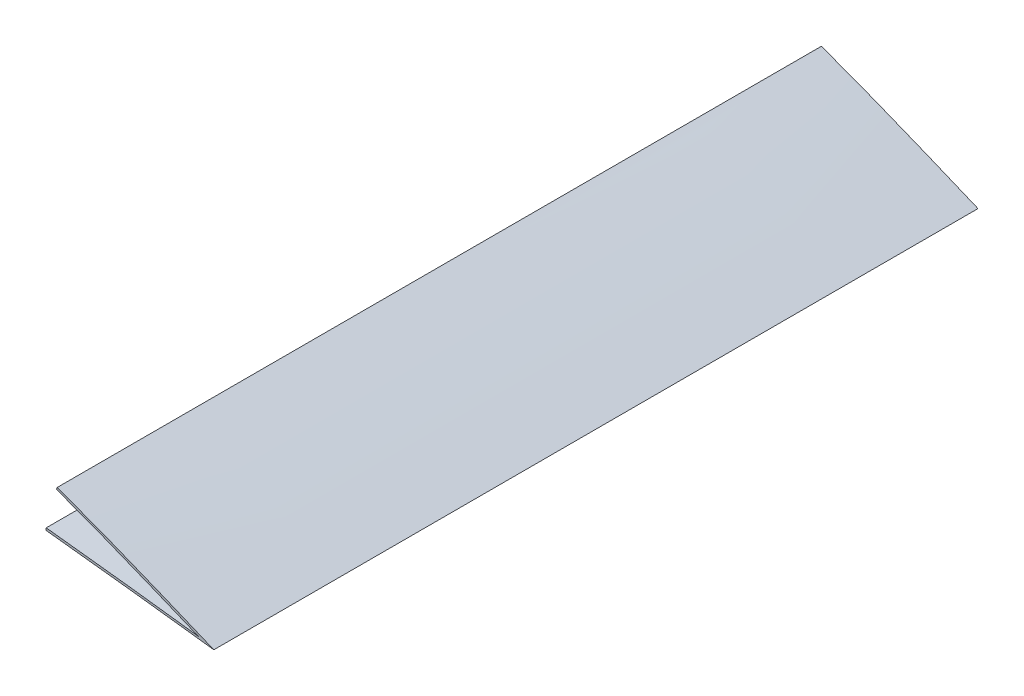
from build123d import *

# Parameters (mm, degrees)
BOSS_EXTRUDE1_DEPTH = 174.625


with BuildPart() as part:
    # Sketch2 → Boss-Extrude1 (new body)
    with BuildSketch(Plane.XY):
        with BuildLine():
            Line((1990.421486693, 2953.497553429), (1990.598028741, 2953.970958412))
            add(Edge.make_bspline(
                [(2026.378123223, 2939.726019749), (2025.772367033, 2939.966817705), (2025.167001193, 2940.208065776), (2024.563270161, 2940.45119895), (2024.252449888, 2940.576371776), (2023.942062924, 2940.702044254), (2023.632279085, 2940.828412198), (2019.922907303, 2942.341550154), (2016.300010508, 2943.954402829), (2008.840382128, 2946.884862912), (2005.182046354, 2948.446003317), (1998.49830219, 2950.992561795), (1995.575349012, 2952.143708473), (1991.935867823, 2953.473628662), (1991.266522782, 2953.72164072), (1990.598028741, 2953.970958412)],
                knots=[0.099020879, 0.099020879, 0.099020879, 0.099020879, 0.175577174, 0.175577174, 0.175577174, 0.214990832, 0.214990832, 0.214990832, 0.686932531, 0.686932531, 1.158874229, 1.158874229, 1.531655023, 1.531655023, 1.615895701, 1.615895701, 1.615895701, 1.615895701], degree=3))
            add(Edge.make_bspline(
                [(1988.02305883, 2944.185998102), (1988.486093696, 2944.140440591), (1990.118619768, 2943.977588834), (1992.878565386, 2943.651927789), (1996.260561822, 2943.27824299), (1999.50276369, 2942.881360992), (2002.595054506, 2942.588170362), (2005.514279258, 2942.198699316), (2008.286301016, 2941.928612986), (2010.885526485, 2941.569057415), (2013.333900984, 2941.299836639), (2015.607898689, 2941.033281035), (2017.705847242, 2940.755050343), (2019.629402987, 2940.578518098), (2021.367662073, 2940.314827517), (2022.931203684, 2940.147471412), (2024.319748194, 2939.977883581), (2025.440549175, 2939.811318081), (2026.113682533, 2939.755557142), (2026.378123223, 2939.726019749)],
                knots=[28.432980691, 28.432980691, 28.432980691, 28.432980691, 28.487933475, 28.626756368, 28.761203264, 28.889815923, 29.012534113, 29.128021866, 29.237609431, 29.341433808, 29.437893302, 29.528519208, 29.611854391, 29.687830524, 29.756590169, 29.81943804, 29.873536901, 29.921805305, 29.953240386, 29.953240386, 29.953240386, 29.953240386], degree=3))
            Line((1988.02305883, 2944.185998102), (1988.074605977, 2944.709910093))
            add(Edge.make_bspline(
                [(1988.074605977, 2944.709910093), (1989.230150517, 2944.58289678), (1990.385621975, 2944.45341125), (1998.052162808, 2943.575786345), (2004.595655519, 2942.866835827), (2014.99093127, 2941.587524984), (2018.884584402, 2941.067615831), (2022.866460843, 2940.614570977)],
                knots=[28.432746502, 28.432746502, 28.432746502, 28.432746502, 28.569989508, 28.569989508, 29.343340852, 29.343340852, 29.81381441, 29.81381441, 29.81381441, 29.81381441], degree=3))
            add(Edge.make_bspline(
                [(2022.866460843, 2940.614570977), (2021.798028907, 2941.061512065), (2020.716308213, 2941.506999086), (2015.217323697, 2943.787839229), (2010.802115728, 2945.575588777), (2001.866334932, 2949.196830335), (1997.44616335, 2950.892375156), (1992.11061417, 2952.870832924), (1991.266086469, 2953.18432728), (1990.421486693, 2953.497553429)],
                knots=[0.240373092, 0.240373092, 0.240373092, 0.240373092, 0.376824745, 0.376824745, 0.94322841, 0.94322841, 1.509632074, 1.509632074, 1.616176715, 1.616176715, 1.616176715, 1.616176715], degree=3))
        make_face()
    extrude(amount=BOSS_EXTRUDE1_DEPTH)


solid = part.part
